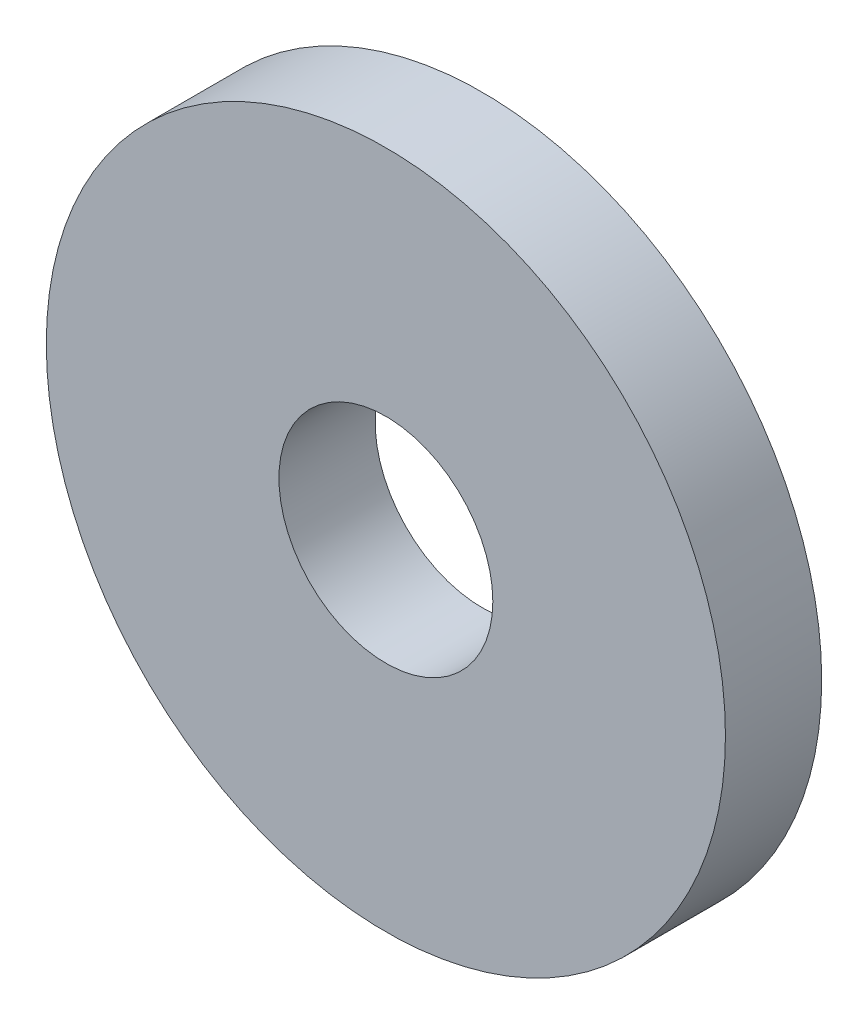
from build123d import *

# Parameters (mm, degrees)
SKETCH1_R           = 15.875
SKETCH1_R_2         = 5
BOSS_EXTRUDE1_DEPTH = 2.25


with BuildPart() as part:
    # Sketch1 → Boss-Extrude1 (new, symmetric)
    with BuildSketch(Plane.XY):
        Circle(SKETCH1_R)
        Circle(SKETCH1_R_2, mode=Mode.SUBTRACT)
    extrude(amount=BOSS_EXTRUDE1_DEPTH, both=True)


solid = part.part
